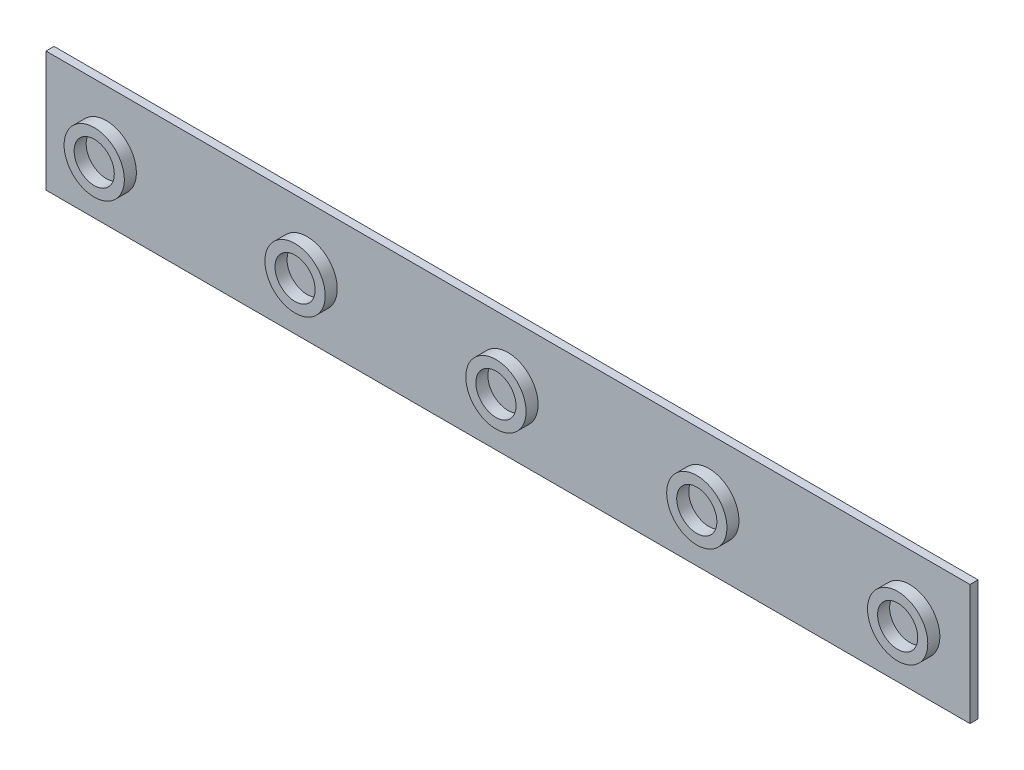
from build123d import *

# Parameters (mm, degrees)
ESQUISSE1_W        = 230
ESQUISSE1_H        = 30
BOSS_EXTRU_1_DEPTH = 2
ESQUISSE2_R        = 7.5
ESQUISSE2_R_2      = 5
BOSS_EXTRU_2_DEPTH = 3


with BuildPart() as part:
    # Esquisse1 → Boss.-Extru.1 (new body)
    with BuildSketch(Plane.XY):
        with Locations((115, 15)):
            Rectangle(ESQUISSE1_W, ESQUISSE1_H)
    extrude(amount=BOSS_EXTRU_1_DEPTH)

    # Esquisse2 → Boss.-Extru.2 (add)
    # profile 1 of 5: a face of its own
    with BuildSketch(Plane.XY.offset(2)):
        with Locations(Location((15, 15, 0), (0, 0, 180))):
            Circle(ESQUISSE2_R)
        with Locations((15, 15)):
            Circle(ESQUISSE2_R_2, mode=Mode.SUBTRACT)
    # profile 2 of 5: a face of its own
    with BuildSketch(Plane.XY.offset(2)):
        with Locations(Location((65, 15, 0), (0, 0, 180))):
            Circle(ESQUISSE2_R)
        with Locations((65, 15)):
            Circle(ESQUISSE2_R_2, mode=Mode.SUBTRACT)
    # profile 3 of 5: a face of its own
    with BuildSketch(Plane.XY.offset(2)):
        with Locations(Location((115, 15, 0), (0, 0, 180))):
            Circle(ESQUISSE2_R)
        with Locations((115, 15)):
            Circle(ESQUISSE2_R_2, mode=Mode.SUBTRACT)
    # profile 4 of 5: a face of its own
    with BuildSketch(Plane.XY.offset(2)):
        with Locations(Location((165, 15, 0), (0, 0, 180))):
            Circle(ESQUISSE2_R)
        with Locations((165, 15)):
            Circle(ESQUISSE2_R_2, mode=Mode.SUBTRACT)
    # profile 5 of 5: a face of its own
    with BuildSketch(Plane.XY.offset(2)):
        with Locations(Location((215, 15, 0), (0, 0, 180))):
            Circle(ESQUISSE2_R)
        with Locations((215, 15)):
            Circle(ESQUISSE2_R_2, mode=Mode.SUBTRACT)
    extrude(amount=BOSS_EXTRU_2_DEPTH)


solid = part.part
